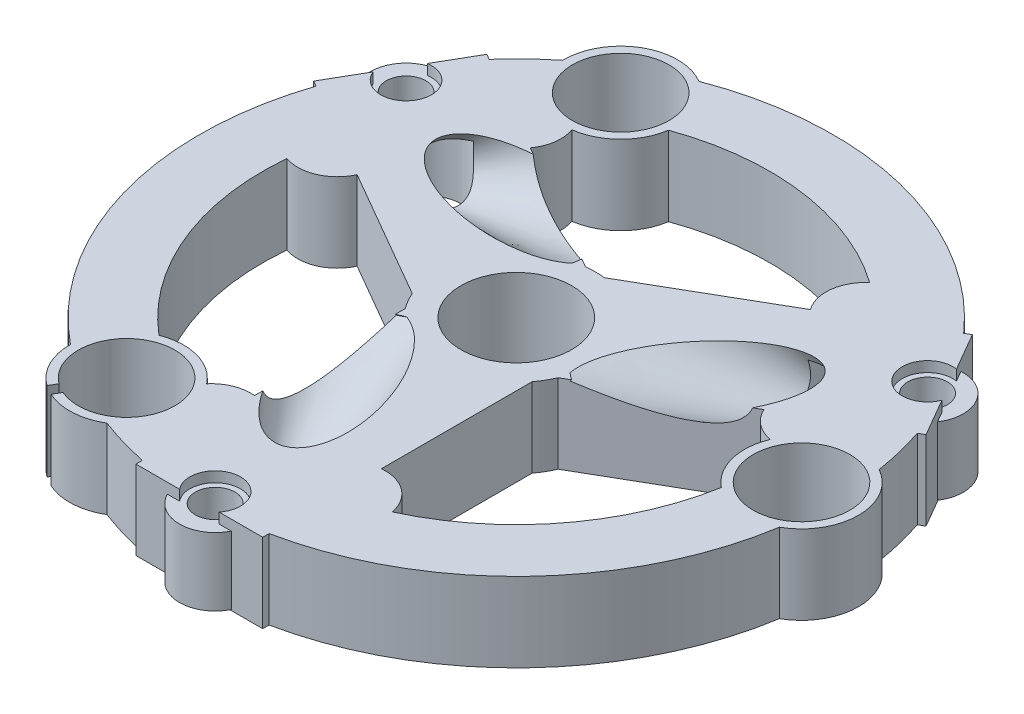
from build123d import *
from build123d.topology import SkipClean

# Parameters (mm, degrees)
MAIN_PROFILE_SKETCH_R              = 6.1
MAIN_EXTRUSION_DEPTH               = 1
DETAIL_PROFILE_2_SKETCH_R          = 6.1
DETAIL_EXTRUSION_2_DEPTH           = 0.31
DETAIL_PROFILE_3_SKETCH_R          = 2.5
DETAIL_PROFILE_3_SKETCH_R_2        = 6.1
DETAIL_EXTRUSION_3_DEPTH           = 0.4
DETAIL_PROFILE_4_SKETCH_R          = 2.5
DETAIL_PROFILE_4_SKETCH_R_2        = 3.95
DETAIL_PROFILE_4_SKETCH_R_3        = 6.1
DETAIL_EXTRUSION_4_DEPTH           = 2.99
DETAIL_PROFILE_5_SKETCH_R          = 1.1
DETAIL_PROFILE_5_SKETCH_R_2        = 2.5
DETAIL_PROFILE_5_SKETCH_R_3        = 3.95
DETAIL_PROFILE_5_SKETCH_R_4        = 6.1
DETAIL_EXTRUSION_5_DEPTH           = 1.3
DETAIL_PROFILE_6_SKETCH_R          = 1.75
DETAIL_PROFILE_6_SKETCH_R_2        = 2.5
DETAIL_PROFILE_6_SKETCH_R_3        = 3.95
DETAIL_PROFILE_6_SKETCH_R_4        = 6.1
DETAIL_EXTRUSION_6_DEPTH           = 3.89
DETAIL_PROFILE_7_SKETCH_R          = 1.75
DETAIL_PROFILE_7_SKETCH_R_2        = 3.95
DETAIL_PROFILE_7_SKETCH_R_3        = 6.1
DETAIL_EXTRUSION_7_DEPTH           = 0.11
CENTRE_INSPECTION_OPENING_SKETCH_R = 7
CENTRE_INSPECTION_OPENING_DEPTH    = 30


with BuildPart() as part:
    # Main Profile Sketch → Main Extrusion (new body)
    with BuildSketch(Plane(origin=(0, -96, 0), x_dir=(-1, 0, 0), z_dir=(0, -1, 0))):
        with BuildLine():
            Line((77.268379179, -37.732758556), (76.715284945, -36.774771242))
            ThreePointArc((76.715284945, -36.774771242), (71.241651246, -25.894159573), (77.92772051, -36.074771242))
            Line((77.92772051, -36.074771242), (78.480814744, -37.032758556))
            ThreePointArc((78.480814744, -37.032758556), (80.720355784, -34.419098671), (81.490773887, -31.064517027))
            ThreePointArc((81.490773887, -31.064517027), (94.694772954, -11.189291445), (94.232776743, 12.667714712))
            Line((94.232776743, 12.667714712), (94.932667397, 13.07179677))
            Line((94.932667397, 13.07179677), (92.181666997, 17.836669235))
            ThreePointArc((92.181666997, 17.836669235), (86.429335298, 17.4), (89.683667798, 22.163330765))
            Line((89.683667798, 22.163330765), (86.932667397, 26.92820323))
            Line((86.932667397, 26.92820323), (86.232776743, 26.524121173))
            ThreePointArc((86.232776743, 26.524121173), (83.955084507, 28.891771496), (81.490773887, 31.064517027))
            ThreePointArc((81.490773887, 31.064517027), (77.891651246, 37.412297443), (70.594750827, 37.355338874))
            ThreePointArc((70.594750827, 37.355338874), (46.780301034, 38.852724707), (26.350525749, 26.524121173))
            Line((26.350525749, 26.524121173), (25.650635095, 26.92820323))
            Line((25.650635095, 26.92820323), (22.899634694, 22.163330765))
            ThreePointArc((22.899634694, 22.163330765), (26.153967194, 17.4), (20.401635495, 17.836669235))
            Line((20.401635495, 17.836669235), (17.650635095, 13.07179677))
            Line((17.650635095, 13.07179677), (18.350525749, 12.667714712))
            ThreePointArc((18.350525749, 12.667714712), (17.438926539, 9.511350212), (16.789429024, 6.290821847))
            ThreePointArc((16.789429024, 6.290821847), (13.091651246, 0), (16.789429024, -6.290821847))
            ThreePointArc((16.789429024, -6.290821847), (27.39987975, -27.663433261), (48.291651246, -39.191835885))
            Line((48.291651246, -39.191835885), (48.291651246, -40))
            Line((48.291651246, -40), (53.793652047, -40))
            ThreePointArc((53.793652047, -40), (56.291651246, -34.8), (58.789650445, -40))
            Line((58.789650445, -40), (64.291651246, -40))
            Line((64.291651246, -40), (64.291651246, -39.191835885))
            ThreePointArc((64.291651246, -39.191835885), (67.480942691, -38.403121708), (70.594750827, -37.355338874))
            ThreePointArc((70.594750827, -37.355338874), (73.885112802, -38.365428047), (77.268379179, -37.732758556))
        make_face()
        with Locations(Location((74.291651246, 31.176914536, 0), (0, 0, 90))):
            Circle(MAIN_PROFILE_SKETCH_R, mode=Mode.SUBTRACT)
        with Locations(Location((20.291651246, 0, 0), (0, 0, 90))):
            Circle(MAIN_PROFILE_SKETCH_R, mode=Mode.SUBTRACT)
        with BuildLine():
            Line((57.487803669, 9.92820323), (73.963991375, 19.440734638))
            ThreePointArc((73.963991375, 19.440734638), (73.071540189, 21.662034378), (73.313956204, 24.043604477))
            ThreePointArc((73.313956204, 24.043604477), (69.238618343, 26.047893335), (67.173727925, 30.09286306))
            ThreePointArc((67.173727925, 30.09286306), (52.019565246, 31.713550435), (37.834445484, 26.14061123))
            ThreePointArc((37.834445484, 26.14061123), (39.526930128, 22.942969172), (38.619311117, 19.440734638))
            Line((38.619311117, 19.440734638), (55.095498823, 9.92820323))
            ThreePointArc((55.095498823, 9.92820323), (56.291651246, 10), (57.487803669, 9.92820323))
        make_face(mode=Mode.SUBTRACT)
        with BuildLine():
            Line((64.291651246, -6), (64.291651246, -25.025062814))
            ThreePointArc((64.291651246, -25.025062814), (66.661578844, -25.362827286), (68.602871042, -26.763550763))
            ThreePointArc((68.602871042, -26.763550763), (72.376305041, -24.236349076), (76.911796789, -24.47058638))
            ThreePointArc((76.911796789, -24.47058638), (85.892434567, -12.157040215), (88.158687522, 2.914103458))
            ThreePointArc((88.158687522, 2.914103458), (84.543205946, 3.04718979), (81.963991375, 5.584328177))
            Line((81.963991375, 5.584328177), (65.487803669, -3.92820323))
            ThreePointArc((65.487803669, -3.92820323), (64.951905284, -5), (64.291651246, -6))
        make_face(mode=Mode.SUBTRACT)
        with BuildLine():
            Line((47.095498823, -3.92820323), (30.619311117, 5.584328177))
            ThreePointArc((30.619311117, 5.584328177), (29.141834705, 3.700792908), (26.958126492, 2.719946286))
            ThreePointArc((26.958126492, 2.719946286), (27.260030354, -1.81154426), (24.789429024, -5.62227668))
            ThreePointArc((24.789429024, -5.62227668), (30.962953925, -19.55651022), (42.881820732, -29.054714688))
            ThreePointArc((42.881820732, -29.054714688), (44.804817664, -25.990158961), (48.291651246, -25.025062814))
            Line((48.291651246, -25.025062814), (48.291651246, -6))
            ThreePointArc((48.291651246, -6), (47.631397208, -5), (47.095498823, -3.92820323))
        make_face(mode=Mode.SUBTRACT)
    extrude(amount=MAIN_EXTRUSION_DEPTH)

    # Detail Profile 2 Sketch → Detail Extrusion 2 (add)
    with BuildSketch(Plane(origin=(0, -97, 0), x_dir=(-1, 0, 0), z_dir=(0, -1, 0))):
        with BuildLine():
            Line((77.268379179, -37.732758556), (76.715284945, -36.774771242))
            ThreePointArc((76.715284945, -36.774771242), (71.241651246, -25.894159573), (77.92772051, -36.074771242))
            Line((77.92772051, -36.074771242), (78.480814744, -37.032758556))
            ThreePointArc((78.480814744, -37.032758556), (80.720355784, -34.419098671), (81.490773887, -31.064517027))
            ThreePointArc((81.490773887, -31.064517027), (94.694772954, -11.189291445), (94.232776743, 12.667714712))
            Line((94.232776743, 12.667714712), (94.932667397, 13.07179677))
            Line((94.932667397, 13.07179677), (92.181666997, 17.836669235))
            ThreePointArc((92.181666997, 17.836669235), (86.429335298, 17.4), (89.683667798, 22.163330765))
            Line((89.683667798, 22.163330765), (86.932667397, 26.92820323))
            Line((86.932667397, 26.92820323), (86.232776743, 26.524121173))
            ThreePointArc((86.232776743, 26.524121173), (83.955084507, 28.891771496), (81.490773887, 31.064517027))
            ThreePointArc((81.490773887, 31.064517027), (77.891651246, 37.412297443), (70.594750827, 37.355338874))
            ThreePointArc((70.594750827, 37.355338874), (46.780301034, 38.852724707), (26.350525749, 26.524121173))
            Line((26.350525749, 26.524121173), (25.650635095, 26.92820323))
            Line((25.650635095, 26.92820323), (22.899634694, 22.163330765))
            ThreePointArc((22.899634694, 22.163330765), (26.153967194, 17.4), (20.401635495, 17.836669235))
            Line((20.401635495, 17.836669235), (17.650635095, 13.07179677))
            Line((17.650635095, 13.07179677), (18.350525749, 12.667714712))
            ThreePointArc((18.350525749, 12.667714712), (17.438926539, 9.511350212), (16.789429024, 6.290821847))
            ThreePointArc((16.789429024, 6.290821847), (13.091651246, 0), (16.789429024, -6.290821847))
            ThreePointArc((16.789429024, -6.290821847), (27.39987975, -27.663433261), (48.291651246, -39.191835885))
            Line((48.291651246, -39.191835885), (48.291651246, -40))
            Line((48.291651246, -40), (53.793652047, -40))
            ThreePointArc((53.793652047, -40), (56.291651246, -34.8), (58.789650445, -40))
            Line((58.789650445, -40), (64.291651246, -40))
            Line((64.291651246, -40), (64.291651246, -39.191835885))
            ThreePointArc((64.291651246, -39.191835885), (67.480942691, -38.403121708), (70.594750827, -37.355338874))
            ThreePointArc((70.594750827, -37.355338874), (73.885112802, -38.365428047), (77.268379179, -37.732758556))
        make_face()
        with Locations(Location((74.291651246, 31.176914536, 0), (0, 0, 90))):
            Circle(DETAIL_PROFILE_2_SKETCH_R, mode=Mode.SUBTRACT)
        with Locations(Location((20.291651246, 0, 0), (0, 0, 90))):
            Circle(DETAIL_PROFILE_2_SKETCH_R, mode=Mode.SUBTRACT)
        with BuildLine():
            Line((79.12241336, 17.383275058), (79.12241336, 12.616724942))
            ThreePointArc((79.12241336, 12.616724942), (86.22241336, 15), (79.12241336, 17.383275058))
        make_face(mode=Mode.SUBTRACT)
        with BuildLine():
            Line((57.487803669, 9.92820323), (73.963991375, 19.440734638))
            ThreePointArc((73.963991375, 19.440734638), (73.071540189, 21.662034378), (73.313956204, 24.043604477))
            ThreePointArc((73.313956204, 24.043604477), (69.238618343, 26.047893335), (67.173727925, 30.09286306))
            ThreePointArc((67.173727925, 30.09286306), (52.019565246, 31.713550435), (37.834445484, 26.14061123))
            ThreePointArc((37.834445484, 26.14061123), (39.526930128, 22.942969172), (38.619311117, 19.440734638))
            Line((38.619311117, 19.440734638), (55.095498823, 9.92820323))
            ThreePointArc((55.095498823, 9.92820323), (56.291651246, 10), (57.487803669, 9.92820323))
        make_face(mode=Mode.SUBTRACT)
        with BuildLine():
            Line((64.291651246, -6), (64.291651246, -25.025062814))
            ThreePointArc((64.291651246, -25.025062814), (66.661578844, -25.362827286), (68.602871042, -26.763550763))
            ThreePointArc((68.602871042, -26.763550763), (72.376305041, -24.236349076), (76.911796789, -24.47058638))
            ThreePointArc((76.911796789, -24.47058638), (85.892434567, -12.157040215), (88.158687522, 2.914103458))
            ThreePointArc((88.158687522, 2.914103458), (84.543205946, 3.04718979), (81.963991375, 5.584328177))
            Line((81.963991375, 5.584328177), (65.487803669, -3.92820323))
            ThreePointArc((65.487803669, -3.92820323), (64.951905284, -5), (64.291651246, -6))
        make_face(mode=Mode.SUBTRACT)
        with BuildLine():
            Line((59.93062799, -28.463657507), (55.802674502, -26.080382449))
            ThreePointArc((55.802674502, -26.080382449), (53.330742759, -27.385517082), (52.341651246, -30))
            ThreePointArc((52.341651246, -30), (57.075405627, -33.871463427), (59.93062799, -28.463657507))
        make_face(mode=Mode.SUBTRACT)
        with BuildLine():
            Line((29.821912388, 11.080382449), (33.949865877, 13.463657507))
            ThreePointArc((33.949865877, 13.463657507), (31.094643514, 18.871463427), (26.360889132, 15))
            ThreePointArc((26.360889132, 15), (27.349980645, 12.385517082), (29.821912388, 11.080382449))
        make_face(mode=Mode.SUBTRACT)
        with BuildLine():
            Line((47.095498823, -3.92820323), (30.619311117, 5.584328177))
            ThreePointArc((30.619311117, 5.584328177), (29.141834705, 3.700792908), (26.958126492, 2.719946286))
            ThreePointArc((26.958126492, 2.719946286), (27.260030354, -1.81154426), (24.789429024, -5.62227668))
            ThreePointArc((24.789429024, -5.62227668), (30.962953925, -19.55651022), (42.881820732, -29.054714688))
            ThreePointArc((42.881820732, -29.054714688), (44.804817664, -25.990158961), (48.291651246, -25.025062814))
            Line((48.291651246, -25.025062814), (48.291651246, -6))
            ThreePointArc((48.291651246, -6), (47.631397208, -5), (47.095498823, -3.92820323))
        make_face(mode=Mode.SUBTRACT)
    extrude(amount=DETAIL_EXTRUSION_2_DEPTH)

    # Detail Profile 3 Sketch → Detail Extrusion 3 (add)
    with BuildSketch(Plane(origin=(0, -97.31, 0), x_dir=(-1, 0, 0), z_dir=(0, -1, 0))):
        with BuildLine():
            Line((77.268379179, -37.732758556), (76.715284945, -36.774771242))
            ThreePointArc((76.715284945, -36.774771242), (71.241651246, -25.894159573), (77.92772051, -36.074771242))
            Line((77.92772051, -36.074771242), (78.480814744, -37.032758556))
            ThreePointArc((78.480814744, -37.032758556), (80.720355784, -34.419098671), (81.490773887, -31.064517027))
            ThreePointArc((81.490773887, -31.064517027), (94.694772954, -11.189291445), (94.232776743, 12.667714712))
            Line((94.232776743, 12.667714712), (94.932667397, 13.07179677))
            Line((94.932667397, 13.07179677), (92.948231834, 16.508939989))
            ThreePointArc((92.948231834, 16.508939989), (93.097730907, 21.25), (88.91710296, 23.491060011))
            Line((88.91710296, 23.491060011), (86.932667397, 26.92820323))
            Line((86.932667397, 26.92820323), (86.232776743, 26.524121173))
            ThreePointArc((86.232776743, 26.524121173), (83.955084507, 28.891771496), (81.490773887, 31.064517027))
            ThreePointArc((81.490773887, 31.064517027), (77.891651246, 37.412297443), (70.594750827, 37.355338874))
            ThreePointArc((70.594750827, 37.355338874), (46.780301034, 38.852724707), (26.350525749, 26.524121173))
            Line((26.350525749, 26.524121173), (25.650635095, 26.92820323))
            Line((25.650635095, 26.92820323), (23.666199532, 23.491060011))
            ThreePointArc((23.666199532, 23.491060011), (19.485571585, 21.25), (19.635070658, 16.508939989))
            Line((19.635070658, 16.508939989), (17.650635095, 13.07179677))
            Line((17.650635095, 13.07179677), (18.350525749, 12.667714712))
            ThreePointArc((18.350525749, 12.667714712), (17.438926539, 9.511350212), (16.789429024, 6.290821847))
            ThreePointArc((16.789429024, 6.290821847), (13.091651246, 0), (16.789429024, -6.290821847))
            ThreePointArc((16.789429024, -6.290821847), (27.39987975, -27.663433261), (48.291651246, -39.191835885))
            Line((48.291651246, -39.191835885), (48.291651246, -40))
            Line((48.291651246, -40), (52.260522372, -40))
            ThreePointArc((52.260522372, -40), (56.291651246, -42.5), (60.32278012, -40))
            Line((60.32278012, -40), (64.291651246, -40))
            Line((64.291651246, -40), (64.291651246, -39.191835885))
            ThreePointArc((64.291651246, -39.191835885), (67.480942691, -38.403121708), (70.594750827, -37.355338874))
            ThreePointArc((70.594750827, -37.355338874), (73.885112802, -38.365428047), (77.268379179, -37.732758556))
        make_face()
        with Locations(Location((89.20061659, 19, 0), (0, 0, 90))):
            Circle(DETAIL_PROFILE_3_SKETCH_R, mode=Mode.SUBTRACT)
        with Locations(Location((74.291651246, 31.176914536, 0), (0, 0, 90))):
            Circle(DETAIL_PROFILE_3_SKETCH_R_2, mode=Mode.SUBTRACT)
        with Locations(Location((56.291651246, -38, 0), (0, 0, 90))):
            Circle(DETAIL_PROFILE_3_SKETCH_R, mode=Mode.SUBTRACT)
        with Locations(Location((23.382685902, 19, 0), (0, 0, 90))):
            Circle(DETAIL_PROFILE_3_SKETCH_R, mode=Mode.SUBTRACT)
        with Locations(Location((20.291651246, 0, 0), (0, 0, 90))):
            Circle(DETAIL_PROFILE_3_SKETCH_R_2, mode=Mode.SUBTRACT)
        with BuildLine():
            Line((79.12241336, 17.383275058), (79.12241336, 12.616724942))
            ThreePointArc((79.12241336, 12.616724942), (86.22241336, 15), (79.12241336, 17.383275058))
        make_face(mode=Mode.SUBTRACT)
        with BuildLine():
            Line((57.487803669, 9.92820323), (73.963991375, 19.440734638))
            ThreePointArc((73.963991375, 19.440734638), (73.071540189, 21.662034378), (73.313956204, 24.043604477))
            ThreePointArc((73.313956204, 24.043604477), (69.238618343, 26.047893335), (67.173727925, 30.09286306))
            ThreePointArc((67.173727925, 30.09286306), (52.019565246, 31.713550435), (37.834445484, 26.14061123))
            ThreePointArc((37.834445484, 26.14061123), (39.526930128, 22.942969172), (38.619311117, 19.440734638))
            Line((38.619311117, 19.440734638), (55.095498823, 9.92820323))
            ThreePointArc((55.095498823, 9.92820323), (56.291651246, 10), (57.487803669, 9.92820323))
        make_face(mode=Mode.SUBTRACT)
        with BuildLine():
            Line((64.291651246, -6), (64.291651246, -25.025062814))
            ThreePointArc((64.291651246, -25.025062814), (66.661578844, -25.362827286), (68.602871042, -26.763550763))
            ThreePointArc((68.602871042, -26.763550763), (72.376305041, -24.236349076), (76.911796789, -24.47058638))
            ThreePointArc((76.911796789, -24.47058638), (85.892434567, -12.157040215), (88.158687522, 2.914103458))
            ThreePointArc((88.158687522, 2.914103458), (84.543205946, 3.04718979), (81.963991375, 5.584328177))
            Line((81.963991375, 5.584328177), (65.487803669, -3.92820323))
            ThreePointArc((65.487803669, -3.92820323), (64.951905284, -5), (64.291651246, -6))
        make_face(mode=Mode.SUBTRACT)
        with BuildLine():
            Line((59.93062799, -28.463657507), (55.802674502, -26.080382449))
            ThreePointArc((55.802674502, -26.080382449), (53.330742759, -27.385517082), (52.341651246, -30))
            ThreePointArc((52.341651246, -30), (57.075405627, -33.871463427), (59.93062799, -28.463657507))
        make_face(mode=Mode.SUBTRACT)
        with BuildLine():
            Line((29.821912388, 11.080382449), (33.949865877, 13.463657507))
            ThreePointArc((33.949865877, 13.463657507), (31.094643514, 18.871463427), (26.360889132, 15))
            ThreePointArc((26.360889132, 15), (27.349980645, 12.385517082), (29.821912388, 11.080382449))
        make_face(mode=Mode.SUBTRACT)
        with BuildLine():
            Line((47.095498823, -3.92820323), (30.619311117, 5.584328177))
            ThreePointArc((30.619311117, 5.584328177), (29.141834705, 3.700792908), (26.958126492, 2.719946286))
            ThreePointArc((26.958126492, 2.719946286), (27.260030354, -1.81154426), (24.789429024, -5.62227668))
            ThreePointArc((24.789429024, -5.62227668), (30.962953925, -19.55651022), (42.881820732, -29.054714688))
            ThreePointArc((42.881820732, -29.054714688), (44.804817664, -25.990158961), (48.291651246, -25.025062814))
            Line((48.291651246, -25.025062814), (48.291651246, -6))
            ThreePointArc((48.291651246, -6), (47.631397208, -5), (47.095498823, -3.92820323))
        make_face(mode=Mode.SUBTRACT)
    extrude(amount=DETAIL_EXTRUSION_3_DEPTH)

    # Detail Profile 4 Sketch → Detail Extrusion 4 (add)
    with BuildSketch(Plane(origin=(0, -97.71, 0), x_dir=(-1, 0, 0), z_dir=(0, -1, 0))):
        with BuildLine():
            Line((77.268379179, -37.732758556), (76.715284945, -36.774771242))
            ThreePointArc((76.715284945, -36.774771242), (71.241651246, -25.894159573), (77.92772051, -36.074771242))
            Line((77.92772051, -36.074771242), (78.480814744, -37.032758556))
            ThreePointArc((78.480814744, -37.032758556), (80.720355784, -34.419098671), (81.490773887, -31.064517027))
            ThreePointArc((81.490773887, -31.064517027), (94.694772954, -11.189291445), (94.232776743, 12.667714712))
            Line((94.232776743, 12.667714712), (94.932667397, 13.07179677))
            Line((94.932667397, 13.07179677), (92.948231834, 16.508939989))
            ThreePointArc((92.948231834, 16.508939989), (93.097730907, 21.25), (88.91710296, 23.491060011))
            Line((88.91710296, 23.491060011), (86.932667397, 26.92820323))
            Line((86.932667397, 26.92820323), (86.232776743, 26.524121173))
            ThreePointArc((86.232776743, 26.524121173), (83.955084507, 28.891771496), (81.490773887, 31.064517027))
            ThreePointArc((81.490773887, 31.064517027), (77.891651246, 37.412297443), (70.594750827, 37.355338874))
            ThreePointArc((70.594750827, 37.355338874), (46.780301034, 38.852724707), (26.350525749, 26.524121173))
            Line((26.350525749, 26.524121173), (25.650635095, 26.92820323))
            Line((25.650635095, 26.92820323), (23.666199532, 23.491060011))
            ThreePointArc((23.666199532, 23.491060011), (19.485571585, 21.25), (19.635070658, 16.508939989))
            Line((19.635070658, 16.508939989), (17.650635095, 13.07179677))
            Line((17.650635095, 13.07179677), (18.350525749, 12.667714712))
            ThreePointArc((18.350525749, 12.667714712), (17.438926539, 9.511350212), (16.789429024, 6.290821847))
            ThreePointArc((16.789429024, 6.290821847), (13.091651246, 0), (16.789429024, -6.290821847))
            ThreePointArc((16.789429024, -6.290821847), (27.39987975, -27.663433261), (48.291651246, -39.191835885))
            Line((48.291651246, -39.191835885), (48.291651246, -40))
            Line((48.291651246, -40), (52.260522372, -40))
            ThreePointArc((52.260522372, -40), (56.291651246, -42.5), (60.32278012, -40))
            Line((60.32278012, -40), (64.291651246, -40))
            Line((64.291651246, -40), (64.291651246, -39.191835885))
            ThreePointArc((64.291651246, -39.191835885), (67.480942691, -38.403121708), (70.594750827, -37.355338874))
            ThreePointArc((70.594750827, -37.355338874), (73.885112802, -38.365428047), (77.268379179, -37.732758556))
        make_face()
        with Locations(Location((89.20061659, 19, 0), (0, 0, 90))):
            Circle(DETAIL_PROFILE_4_SKETCH_R, mode=Mode.SUBTRACT)
        with Locations(Location((82.27241336, 15, 0), (0, 0, 217.110976457))):
            Circle(DETAIL_PROFILE_4_SKETCH_R_2, mode=Mode.SUBTRACT)
        with Locations(Location((74.291651246, 31.176914536, 0), (0, 0, 90))):
            Circle(DETAIL_PROFILE_4_SKETCH_R_3, mode=Mode.SUBTRACT)
        with Locations(Location((56.291651246, -30, 0), (0, 0, 22.889023543))):
            Circle(DETAIL_PROFILE_4_SKETCH_R_2, mode=Mode.SUBTRACT)
        with Locations(Location((56.291651246, -38, 0), (0, 0, 90))):
            Circle(DETAIL_PROFILE_4_SKETCH_R, mode=Mode.SUBTRACT)
        with Locations(Location((30.310889132, 15, 0), (0, 0, 262.889023543))):
            Circle(DETAIL_PROFILE_4_SKETCH_R_2, mode=Mode.SUBTRACT)
        with Locations(Location((23.382685902, 19, 0), (0, 0, 90))):
            Circle(DETAIL_PROFILE_4_SKETCH_R, mode=Mode.SUBTRACT)
        with Locations(Location((20.291651246, 0, 0), (0, 0, 90))):
            Circle(DETAIL_PROFILE_4_SKETCH_R_3, mode=Mode.SUBTRACT)
        with BuildLine():
            Line((57.487803669, 9.92820323), (73.963991375, 19.440734638))
            ThreePointArc((73.963991375, 19.440734638), (73.071540189, 21.662034378), (73.313956204, 24.043604477))
            ThreePointArc((73.313956204, 24.043604477), (69.238618343, 26.047893335), (67.173727925, 30.09286306))
            ThreePointArc((67.173727925, 30.09286306), (52.019565246, 31.713550435), (37.834445484, 26.14061123))
            ThreePointArc((37.834445484, 26.14061123), (39.526930128, 22.942969172), (38.619311117, 19.440734638))
            Line((38.619311117, 19.440734638), (55.095498823, 9.92820323))
            ThreePointArc((55.095498823, 9.92820323), (56.291651246, 10), (57.487803669, 9.92820323))
        make_face(mode=Mode.SUBTRACT)
        with BuildLine():
            Line((64.291651246, -6), (64.291651246, -25.025062814))
            ThreePointArc((64.291651246, -25.025062814), (66.661578844, -25.362827286), (68.602871042, -26.763550763))
            ThreePointArc((68.602871042, -26.763550763), (72.376305041, -24.236349076), (76.911796789, -24.47058638))
            ThreePointArc((76.911796789, -24.47058638), (85.892434567, -12.157040215), (88.158687522, 2.914103458))
            ThreePointArc((88.158687522, 2.914103458), (84.543205946, 3.04718979), (81.963991375, 5.584328177))
            Line((81.963991375, 5.584328177), (65.487803669, -3.92820323))
            ThreePointArc((65.487803669, -3.92820323), (64.951905284, -5), (64.291651246, -6))
        make_face(mode=Mode.SUBTRACT)
        with BuildLine():
            Line((47.095498823, -3.92820323), (30.619311117, 5.584328177))
            ThreePointArc((30.619311117, 5.584328177), (29.141834705, 3.700792908), (26.958126492, 2.719946286))
            ThreePointArc((26.958126492, 2.719946286), (27.260030354, -1.81154426), (24.789429024, -5.62227668))
            ThreePointArc((24.789429024, -5.62227668), (30.962953925, -19.55651022), (42.881820732, -29.054714688))
            ThreePointArc((42.881820732, -29.054714688), (44.804817664, -25.990158961), (48.291651246, -25.025062814))
            Line((48.291651246, -25.025062814), (48.291651246, -6))
            ThreePointArc((48.291651246, -6), (47.631397208, -5), (47.095498823, -3.92820323))
        make_face(mode=Mode.SUBTRACT)
    extrude(amount=DETAIL_EXTRUSION_4_DEPTH)

    # Detail Profile 5 Sketch → Detail Extrusion 5 (add)
    with BuildSketch(Plane(origin=(0, -100.7, 0), x_dir=(-1, 0, 0), z_dir=(0, -1, 0))):
        with BuildLine():
            Line((77.268379179, -37.732758556), (76.715284945, -36.774771242))
            ThreePointArc((76.715284945, -36.774771242), (71.241651246, -25.894159573), (77.92772051, -36.074771242))
            Line((77.92772051, -36.074771242), (78.480814744, -37.032758556))
            ThreePointArc((78.480814744, -37.032758556), (80.720355784, -34.419098671), (81.490773887, -31.064517027))
            ThreePointArc((81.490773887, -31.064517027), (94.694772954, -11.189291445), (94.232776743, 12.667714712))
            Line((94.232776743, 12.667714712), (94.932667397, 13.07179677))
            Line((94.932667397, 13.07179677), (92.948231834, 16.508939989))
            ThreePointArc((92.948231834, 16.508939989), (93.097730907, 21.25), (88.91710296, 23.491060011))
            Line((88.91710296, 23.491060011), (86.932667397, 26.92820323))
            Line((86.932667397, 26.92820323), (86.232776743, 26.524121173))
            ThreePointArc((86.232776743, 26.524121173), (83.955084507, 28.891771496), (81.490773887, 31.064517027))
            ThreePointArc((81.490773887, 31.064517027), (77.891651246, 37.412297443), (70.594750827, 37.355338874))
            ThreePointArc((70.594750827, 37.355338874), (46.780301034, 38.852724707), (26.350525749, 26.524121173))
            Line((26.350525749, 26.524121173), (25.650635095, 26.92820323))
            Line((25.650635095, 26.92820323), (23.666199532, 23.491060011))
            ThreePointArc((23.666199532, 23.491060011), (19.485571585, 21.25), (19.635070658, 16.508939989))
            Line((19.635070658, 16.508939989), (17.650635095, 13.07179677))
            Line((17.650635095, 13.07179677), (18.350525749, 12.667714712))
            ThreePointArc((18.350525749, 12.667714712), (17.438926539, 9.511350212), (16.789429024, 6.290821847))
            ThreePointArc((16.789429024, 6.290821847), (13.091651246, 0), (16.789429024, -6.290821847))
            ThreePointArc((16.789429024, -6.290821847), (27.39987975, -27.663433261), (48.291651246, -39.191835885))
            Line((48.291651246, -39.191835885), (48.291651246, -40))
            Line((48.291651246, -40), (52.260522372, -40))
            ThreePointArc((52.260522372, -40), (56.291651246, -42.5), (60.32278012, -40))
            Line((60.32278012, -40), (64.291651246, -40))
            Line((64.291651246, -40), (64.291651246, -39.191835885))
            ThreePointArc((64.291651246, -39.191835885), (67.480942691, -38.403121708), (70.594750827, -37.355338874))
            ThreePointArc((70.594750827, -37.355338874), (73.885112802, -38.365428047), (77.268379179, -37.732758556))
        make_face()
        with Locations(Location((78.02241336, 22.361215932, 0), (0, 0, 90))):
            Circle(DETAIL_PROFILE_5_SKETCH_R, mode=Mode.SUBTRACT)
        with Locations(Location((89.20061659, 19, 0), (0, 0, 90))):
            Circle(DETAIL_PROFILE_5_SKETCH_R_2, mode=Mode.SUBTRACT)
        with Locations(Location((86.52241336, 7.638784068, 0), (0, 0, 90))):
            Circle(DETAIL_PROFILE_5_SKETCH_R, mode=Mode.SUBTRACT)
        with Locations(Location((82.27241336, 15, 0), (0, 0, 217.110976457))):
            Circle(DETAIL_PROFILE_5_SKETCH_R_3, mode=Mode.SUBTRACT)
        with Locations(Location((74.291651246, 31.176914536, 0), (0, 0, 90))):
            Circle(DETAIL_PROFILE_5_SKETCH_R_4, mode=Mode.SUBTRACT)
        with Locations(Location((64.791651246, -30, 0), (0, 0, 90))):
            Circle(DETAIL_PROFILE_5_SKETCH_R, mode=Mode.SUBTRACT)
        with Locations(Location((56.291651246, -30, 0), (0, 0, 22.889023543))):
            Circle(DETAIL_PROFILE_5_SKETCH_R_3, mode=Mode.SUBTRACT)
        with Locations(Location((56.291651246, -38, 0), (0, 0, 90))):
            Circle(DETAIL_PROFILE_5_SKETCH_R_2, mode=Mode.SUBTRACT)
        with Locations(Location((34.560889132, 22.361215932, 0), (0, 0, 90))):
            Circle(DETAIL_PROFILE_5_SKETCH_R, mode=Mode.SUBTRACT)
        with Locations(Location((30.310889132, 15, 0), (0, 0, 262.889023543))):
            Circle(DETAIL_PROFILE_5_SKETCH_R_3, mode=Mode.SUBTRACT)
        with Locations(Location((26.060889132, 7.638784068, 0), (0, 0, 90))):
            Circle(DETAIL_PROFILE_5_SKETCH_R, mode=Mode.SUBTRACT)
        with Locations(Location((23.382685902, 19, 0), (0, 0, 90))):
            Circle(DETAIL_PROFILE_5_SKETCH_R_2, mode=Mode.SUBTRACT)
        with Locations(Location((20.291651246, 0, 0), (0, 0, 90))):
            Circle(DETAIL_PROFILE_5_SKETCH_R_4, mode=Mode.SUBTRACT)
        with Locations(Location((47.791651246, -30, 0), (0, 0, 90))):
            Circle(DETAIL_PROFILE_5_SKETCH_R, mode=Mode.SUBTRACT)
        with BuildLine():
            Line((57.487803669, 9.92820323), (73.963991375, 19.440734638))
            ThreePointArc((73.963991375, 19.440734638), (73.071540189, 21.662034378), (73.313956204, 24.043604477))
            ThreePointArc((73.313956204, 24.043604477), (69.238618343, 26.047893335), (67.173727925, 30.09286306))
            ThreePointArc((67.173727925, 30.09286306), (52.019565246, 31.713550435), (37.834445484, 26.14061123))
            ThreePointArc((37.834445484, 26.14061123), (39.526930128, 22.942969172), (38.619311117, 19.440734638))
            Line((38.619311117, 19.440734638), (55.095498823, 9.92820323))
            ThreePointArc((55.095498823, 9.92820323), (56.291651246, 10), (57.487803669, 9.92820323))
        make_face(mode=Mode.SUBTRACT)
        with BuildLine():
            Line((64.291651246, -6), (64.291651246, -25.025062814))
            ThreePointArc((64.291651246, -25.025062814), (66.661578844, -25.362827286), (68.602871042, -26.763550763))
            ThreePointArc((68.602871042, -26.763550763), (72.376305041, -24.236349076), (76.911796789, -24.47058638))
            ThreePointArc((76.911796789, -24.47058638), (85.892434567, -12.157040215), (88.158687522, 2.914103458))
            ThreePointArc((88.158687522, 2.914103458), (84.543205946, 3.04718979), (81.963991375, 5.584328177))
            Line((81.963991375, 5.584328177), (65.487803669, -3.92820323))
            ThreePointArc((65.487803669, -3.92820323), (64.951905284, -5), (64.291651246, -6))
        make_face(mode=Mode.SUBTRACT)
        with BuildLine():
            Line((47.095498823, -3.92820323), (30.619311117, 5.584328177))
            ThreePointArc((30.619311117, 5.584328177), (29.141834705, 3.700792908), (26.958126492, 2.719946286))
            ThreePointArc((26.958126492, 2.719946286), (27.260030354, -1.81154426), (24.789429024, -5.62227668))
            ThreePointArc((24.789429024, -5.62227668), (30.962953925, -19.55651022), (42.881820732, -29.054714688))
            ThreePointArc((42.881820732, -29.054714688), (44.804817664, -25.990158961), (48.291651246, -25.025062814))
            Line((48.291651246, -25.025062814), (48.291651246, -6))
            ThreePointArc((48.291651246, -6), (47.631397208, -5), (47.095498823, -3.92820323))
        make_face(mode=Mode.SUBTRACT)
    extrude(amount=DETAIL_EXTRUSION_5_DEPTH)

    # Detail Profile 6 Sketch → Detail Extrusion 6 (add)
    with BuildSketch(Plane(origin=(0, -102, 0), x_dir=(-1, 0, 0), z_dir=(0, -1, 0))):
        with BuildLine():
            Line((77.268379179, -37.732758556), (76.715284945, -36.774771242))
            ThreePointArc((76.715284945, -36.774771242), (71.241651246, -25.894159573), (77.92772051, -36.074771242))
            Line((77.92772051, -36.074771242), (78.480814744, -37.032758556))
            ThreePointArc((78.480814744, -37.032758556), (80.720355784, -34.419098671), (81.490773887, -31.064517027))
            ThreePointArc((81.490773887, -31.064517027), (94.694772954, -11.189291445), (94.232776743, 12.667714712))
            Line((94.232776743, 12.667714712), (94.932667397, 13.07179677))
            Line((94.932667397, 13.07179677), (92.948231834, 16.508939989))
            ThreePointArc((92.948231834, 16.508939989), (93.097730907, 21.25), (88.91710296, 23.491060011))
            Line((88.91710296, 23.491060011), (86.932667397, 26.92820323))
            Line((86.932667397, 26.92820323), (86.232776743, 26.524121173))
            ThreePointArc((86.232776743, 26.524121173), (83.955084507, 28.891771496), (81.490773887, 31.064517027))
            ThreePointArc((81.490773887, 31.064517027), (77.891651246, 37.412297443), (70.594750827, 37.355338874))
            ThreePointArc((70.594750827, 37.355338874), (46.780301034, 38.852724707), (26.350525749, 26.524121173))
            Line((26.350525749, 26.524121173), (25.650635095, 26.92820323))
            Line((25.650635095, 26.92820323), (23.666199532, 23.491060011))
            ThreePointArc((23.666199532, 23.491060011), (19.485571585, 21.25), (19.635070658, 16.508939989))
            Line((19.635070658, 16.508939989), (17.650635095, 13.07179677))
            Line((17.650635095, 13.07179677), (18.350525749, 12.667714712))
            ThreePointArc((18.350525749, 12.667714712), (17.438926539, 9.511350212), (16.789429024, 6.290821847))
            ThreePointArc((16.789429024, 6.290821847), (13.091651246, 0), (16.789429024, -6.290821847))
            ThreePointArc((16.789429024, -6.290821847), (27.39987975, -27.663433261), (48.291651246, -39.191835885))
            Line((48.291651246, -39.191835885), (48.291651246, -40))
            Line((48.291651246, -40), (52.260522372, -40))
            ThreePointArc((52.260522372, -40), (56.291651246, -42.5), (60.32278012, -40))
            Line((60.32278012, -40), (64.291651246, -40))
            Line((64.291651246, -40), (64.291651246, -39.191835885))
            ThreePointArc((64.291651246, -39.191835885), (67.480942691, -38.403121708), (70.594750827, -37.355338874))
            ThreePointArc((70.594750827, -37.355338874), (73.885112802, -38.365428047), (77.268379179, -37.732758556))
        make_face()
        with Locations(Location((78.02241336, 22.361215932, 0), (0, 0, 90))):
            Circle(DETAIL_PROFILE_6_SKETCH_R, mode=Mode.SUBTRACT)
        with Locations(Location((89.20061659, 19, 0), (0, 0, 90))):
            Circle(DETAIL_PROFILE_6_SKETCH_R_2, mode=Mode.SUBTRACT)
        with Locations(Location((86.52241336, 7.638784068, 0), (0, 0, 90))):
            Circle(DETAIL_PROFILE_6_SKETCH_R, mode=Mode.SUBTRACT)
        with Locations(Location((82.27241336, 15, 0), (0, 0, 217.110976457))):
            Circle(DETAIL_PROFILE_6_SKETCH_R_3, mode=Mode.SUBTRACT)
        with Locations(Location((74.291651246, 31.176914536, 0), (0, 0, 90))):
            Circle(DETAIL_PROFILE_6_SKETCH_R_4, mode=Mode.SUBTRACT)
        with Locations(Location((64.791651246, -30, 0), (0, 0, 90))):
            Circle(DETAIL_PROFILE_6_SKETCH_R, mode=Mode.SUBTRACT)
        with Locations(Location((56.291651246, -30, 0), (0, 0, 22.889023543))):
            Circle(DETAIL_PROFILE_6_SKETCH_R_3, mode=Mode.SUBTRACT)
        with Locations(Location((56.291651246, -38, 0), (0, 0, 90))):
            Circle(DETAIL_PROFILE_6_SKETCH_R_2, mode=Mode.SUBTRACT)
        with Locations(Location((34.560889132, 22.361215932, 0), (0, 0, 90))):
            Circle(DETAIL_PROFILE_6_SKETCH_R, mode=Mode.SUBTRACT)
        with Locations(Location((30.310889132, 15, 0), (0, 0, 262.889023543))):
            Circle(DETAIL_PROFILE_6_SKETCH_R_3, mode=Mode.SUBTRACT)
        with Locations(Location((26.060889132, 7.638784068, 0), (0, 0, 90))):
            Circle(DETAIL_PROFILE_6_SKETCH_R, mode=Mode.SUBTRACT)
        with Locations(Location((23.382685902, 19, 0), (0, 0, 90))):
            Circle(DETAIL_PROFILE_6_SKETCH_R_2, mode=Mode.SUBTRACT)
        with Locations(Location((20.291651246, 0, 0), (0, 0, 90))):
            Circle(DETAIL_PROFILE_6_SKETCH_R_4, mode=Mode.SUBTRACT)
        with Locations(Location((47.791651246, -30, 0), (0, 0, 90))):
            Circle(DETAIL_PROFILE_6_SKETCH_R, mode=Mode.SUBTRACT)
        with BuildLine():
            Line((57.487803669, 9.92820323), (73.963991375, 19.440734638))
            ThreePointArc((73.963991375, 19.440734638), (73.071540189, 21.662034378), (73.313956204, 24.043604477))
            ThreePointArc((73.313956204, 24.043604477), (69.238618343, 26.047893335), (67.173727925, 30.09286306))
            ThreePointArc((67.173727925, 30.09286306), (52.019565246, 31.713550435), (37.834445484, 26.14061123))
            ThreePointArc((37.834445484, 26.14061123), (39.526930128, 22.942969172), (38.619311117, 19.440734638))
            Line((38.619311117, 19.440734638), (55.095498823, 9.92820323))
            ThreePointArc((55.095498823, 9.92820323), (56.291651246, 10), (57.487803669, 9.92820323))
        make_face(mode=Mode.SUBTRACT)
        with BuildLine():
            Line((64.291651246, -6), (64.291651246, -25.025062814))
            ThreePointArc((64.291651246, -25.025062814), (66.661578844, -25.362827286), (68.602871042, -26.763550763))
            ThreePointArc((68.602871042, -26.763550763), (72.376305041, -24.236349076), (76.911796789, -24.47058638))
            ThreePointArc((76.911796789, -24.47058638), (85.892434567, -12.157040215), (88.158687522, 2.914103458))
            ThreePointArc((88.158687522, 2.914103458), (84.543205946, 3.04718979), (81.963991375, 5.584328177))
            Line((81.963991375, 5.584328177), (65.487803669, -3.92820323))
            ThreePointArc((65.487803669, -3.92820323), (64.951905284, -5), (64.291651246, -6))
        make_face(mode=Mode.SUBTRACT)
        with BuildLine():
            Line((47.095498823, -3.92820323), (30.619311117, 5.584328177))
            ThreePointArc((30.619311117, 5.584328177), (29.141834705, 3.700792908), (26.958126492, 2.719946286))
            ThreePointArc((26.958126492, 2.719946286), (27.260030354, -1.81154426), (24.789429024, -5.62227668))
            ThreePointArc((24.789429024, -5.62227668), (30.962953925, -19.55651022), (42.881820732, -29.054714688))
            ThreePointArc((42.881820732, -29.054714688), (44.804817664, -25.990158961), (48.291651246, -25.025062814))
            Line((48.291651246, -25.025062814), (48.291651246, -6))
            ThreePointArc((48.291651246, -6), (47.631397208, -5), (47.095498823, -3.92820323))
        make_face(mode=Mode.SUBTRACT)
    extrude(amount=DETAIL_EXTRUSION_6_DEPTH)

    # Detail Profile 7 Sketch → Detail Extrusion 7 (add)
    with SkipClean():  # the faces are left unmerged after this step: merging them gives an invalid solid
        with BuildSketch(Plane(origin=(0, -105.89, 0), x_dir=(-1, 0, 0), z_dir=(0, -1, 0))):
            with BuildLine():
                Line((77.268379179, -37.732758556), (76.715284945, -36.774771242))
                ThreePointArc((76.715284945, -36.774771242), (71.241651246, -25.894159573), (77.92772051, -36.074771242))
                Line((77.92772051, -36.074771242), (78.480814744, -37.032758556))
                ThreePointArc((78.480814744, -37.032758556), (80.720355784, -34.419098671), (81.490773887, -31.064517027))
                ThreePointArc((81.490773887, -31.064517027), (94.694772954, -11.189291445), (94.232776743, 12.667714712))
                Line((94.232776743, 12.667714712), (94.932667397, 13.07179677))
                Line((94.932667397, 13.07179677), (91.682667397, 18.700961894))
                ThreePointArc((91.682667397, 18.700961894), (87.33010927, 17.341325117), (89.20061659, 21.5))
                ThreePointArc((89.20061659, 21.5), (89.701817515, 21.449244298), (90.182667397, 21.299038106))
                Line((90.182667397, 21.299038106), (86.932667397, 26.92820323))
                Line((86.932667397, 26.92820323), (86.232776743, 26.524121173))
                ThreePointArc((86.232776743, 26.524121173), (83.955084507, 28.891771496), (81.490773887, 31.064517027))
                ThreePointArc((81.490773887, 31.064517027), (77.891651246, 37.412297443), (70.594750827, 37.355338874))
                ThreePointArc((70.594750827, 37.355338874), (46.780301034, 38.852724707), (26.350525749, 26.524121173))
                Line((26.350525749, 26.524121173), (25.650635095, 26.92820323))
                Line((25.650635095, 26.92820323), (22.400635095, 21.299038106))
                ThreePointArc((22.400635095, 21.299038106), (22.881484976, 21.449244298), (23.382685902, 21.5))
                ThreePointArc((23.382685902, 21.5), (25.253193222, 17.341325117), (20.900635095, 18.700961894))
                Line((20.900635095, 18.700961894), (17.650635095, 13.07179677))
                Line((17.650635095, 13.07179677), (18.350525749, 12.667714712))
                ThreePointArc((18.350525749, 12.667714712), (17.438926539, 9.511350212), (16.789429024, 6.290821847))
                ThreePointArc((16.789429024, 6.290821847), (13.091651246, 0), (16.789429024, -6.290821847))
                ThreePointArc((16.789429024, -6.290821847), (27.39987975, -27.663433261), (48.291651246, -39.191835885))
                Line((48.291651246, -39.191835885), (48.291651246, -40))
                Line((48.291651246, -40), (54.791651246, -40))
                ThreePointArc((54.791651246, -40), (53.919943001, -37.209430585), (56.291651246, -35.5))
                ThreePointArc((56.291651246, -35.5), (58.663359491, -37.209430585), (57.791651246, -40))
                Line((57.791651246, -40), (64.291651246, -40))
                Line((64.291651246, -40), (64.291651246, -39.191835885))
                ThreePointArc((64.291651246, -39.191835885), (67.480942691, -38.403121708), (70.594750827, -37.355338874))
                ThreePointArc((70.594750827, -37.355338874), (73.885112802, -38.365428047), (77.268379179, -37.732758556))
            make_face()
            with Locations(Location((78.02241336, 22.361215932, 0), (0, 0, 90))):
                Circle(DETAIL_PROFILE_7_SKETCH_R, mode=Mode.SUBTRACT)
            with Locations(Location((86.52241336, 7.638784068, 0), (0, 0, 90))):
                Circle(DETAIL_PROFILE_7_SKETCH_R, mode=Mode.SUBTRACT)
            with Locations(Location((82.27241336, 15, 0), (0, 0, 217.110976457))):
                Circle(DETAIL_PROFILE_7_SKETCH_R_2, mode=Mode.SUBTRACT)
            with Locations(Location((74.291651246, 31.176914536, 0), (0, 0, 90))):
                Circle(DETAIL_PROFILE_7_SKETCH_R_3, mode=Mode.SUBTRACT)
            with Locations(Location((64.791651246, -30, 0), (0, 0, 90))):
                Circle(DETAIL_PROFILE_7_SKETCH_R, mode=Mode.SUBTRACT)
            with Locations(Location((56.291651246, -30, 0), (0, 0, 22.889023543))):
                Circle(DETAIL_PROFILE_7_SKETCH_R_2, mode=Mode.SUBTRACT)
            with Locations(Location((34.560889132, 22.361215932, 0), (0, 0, 90))):
                Circle(DETAIL_PROFILE_7_SKETCH_R, mode=Mode.SUBTRACT)
            with Locations(Location((30.310889132, 15, 0), (0, 0, 262.889023543))):
                Circle(DETAIL_PROFILE_7_SKETCH_R_2, mode=Mode.SUBTRACT)
            with Locations(Location((26.060889132, 7.638784068, 0), (0, 0, 90))):
                Circle(DETAIL_PROFILE_7_SKETCH_R, mode=Mode.SUBTRACT)
            with Locations(Location((47.791651246, -30, 0), (0, 0, 90))):
                Circle(DETAIL_PROFILE_7_SKETCH_R, mode=Mode.SUBTRACT)
            with Locations(Location((20.291651246, 0, 0), (0, 0, 90))):
                Circle(DETAIL_PROFILE_7_SKETCH_R_3, mode=Mode.SUBTRACT)
            with BuildLine():
                Line((57.487803669, 9.92820323), (73.963991375, 19.440734638))
                ThreePointArc((73.963991375, 19.440734638), (73.071540189, 21.662034378), (73.313956204, 24.043604477))
                ThreePointArc((73.313956204, 24.043604477), (69.238618343, 26.047893335), (67.173727925, 30.09286306))
                ThreePointArc((67.173727925, 30.09286306), (52.019565246, 31.713550435), (37.834445484, 26.14061123))
                ThreePointArc((37.834445484, 26.14061123), (39.526930128, 22.942969172), (38.619311117, 19.440734638))
                Line((38.619311117, 19.440734638), (55.095498823, 9.92820323))
                ThreePointArc((55.095498823, 9.92820323), (56.291651246, 10), (57.487803669, 9.92820323))
            make_face(mode=Mode.SUBTRACT)
            with BuildLine():
                Line((64.291651246, -6), (64.291651246, -25.025062814))
                ThreePointArc((64.291651246, -25.025062814), (66.661578844, -25.362827286), (68.602871042, -26.763550763))
                ThreePointArc((68.602871042, -26.763550763), (72.376305041, -24.236349076), (76.911796789, -24.47058638))
                ThreePointArc((76.911796789, -24.47058638), (85.892434567, -12.157040215), (88.158687522, 2.914103458))
                ThreePointArc((88.158687522, 2.914103458), (84.543205946, 3.04718979), (81.963991375, 5.584328177))
                Line((81.963991375, 5.584328177), (65.487803669, -3.92820323))
                ThreePointArc((65.487803669, -3.92820323), (64.951905284, -5), (64.291651246, -6))
            make_face(mode=Mode.SUBTRACT)
            with BuildLine():
                Line((47.095498823, -3.92820323), (30.619311117, 5.584328177))
                ThreePointArc((30.619311117, 5.584328177), (29.141834705, 3.700792908), (26.958126492, 2.719946286))
                ThreePointArc((26.958126492, 2.719946286), (27.260030354, -1.81154426), (24.789429024, -5.62227668))
                ThreePointArc((24.789429024, -5.62227668), (30.962953925, -19.55651022), (42.881820732, -29.054714688))
                ThreePointArc((42.881820732, -29.054714688), (44.804817664, -25.990158961), (48.291651246, -25.025062814))
                Line((48.291651246, -25.025062814), (48.291651246, -6))
                ThreePointArc((48.291651246, -6), (47.631397208, -5), (47.095498823, -3.92820323))
            make_face(mode=Mode.SUBTRACT)
        extrude(amount=DETAIL_EXTRUSION_7_DEPTH)

    # Compression Articulation Throat 61 Sketc → Compression Articulation Throat 61 (revolve, cut)
    with SkipClean():  # the faces are left unmerged after this step: merging them gives an invalid solid
        with BuildSketch(Plane(origin=(21.848129609, -32.292361412, -7.122138515), x_dir=(-0.8343429620590533, -0.5383086561091639, -0.11872494439026368), z_dir=(0.551245699903886, -0.8147619813060818, -0.17969722356136372)), mode=Mode.PRIVATE) as compression_articulation_throat_61_sk:
            Polygon((124.793457491, -7.104979762), (124.793457491, -4.804979762), (101.793457491, 1.915020238), (101.793457491, -7.104979762), align=None)
        revolve(compression_articulation_throat_61_sk.sketch.rotate(Axis((-90.61584298, -106.383086561, -16.187249444), (0.8343429620590537, 0.5383086561091633, 0.11872494439026321)), 131.651059047), axis=Axis((-90.61584298, -106.383086561, -16.187249444), (0.8343429620590537, 0.5383086561091633, 0.11872494439026321)), mode=Mode.SUBTRACT)

    # Compression Articulation Throat 68 Sketc → Compression Articulation Throat 68 (revolve, cut)
    with SkipClean():  # the faces are left unmerged after this step: merging them gives an invalid solid
        with BuildSketch(Plane(origin=(-55.559435073, -21.315405316, -26.260716517), x_dir=(0.37694407644157146, 0.1446147852349051, -0.9148768917876727), z_dir=(0.8541721659092646, 0.32770358269776195, 0.4037329227012915)), mode=Mode.PRIVATE) as compression_articulation_throat_68_sk:
            Polygon((-12.308450042, -83.441173866), (-10.724100051, -81.773890115), (-22.767880189, -61.059022025), (-28.981287547, -67.597673951), align=None)
        revolve(compression_articulation_throat_68_sk.sketch.rotate(Axis((-25.110986143, -106.383086561, -21.631997284), (-0.5199902989343897, 0.5383086561091633, 0.6631997284167648)), 150.064223319), axis=Axis((-25.110986143, -106.383086561, -21.631997284), (-0.5199902989343897, 0.5383086561091633, 0.6631997284167648)), mode=Mode.SUBTRACT)

    # Compression Articulation Throat 75 Sketc → Compression Articulation Throat 75 (revolve, cut)
    with SkipClean():  # the faces are left unmerged after this step: merging them gives an invalid solid
        with BuildSketch(Plane(origin=(-75.19414337, -14.119516346, 20.509419779), x_dir=(-0.2544785459472912, -0.04778449262394895, -0.9658971539026421), z_dir=(0.9493062747008634, 0.17825517869277502, -0.2589260282064664)), mode=Mode.PRIVATE) as compression_articulation_throat_75_sk:
            Polygon((-9.825663304, -88.876600419), (-8.475389129, -90.738524062), (14.088996194, -82.675837476), (8.793573125, -75.373858667), align=None)
        revolve(compression_articulation_throat_75_sk.sketch.rotate(Axis((-53.148124615, -106.383086561, 37.819246728), (-0.3143526631246646, 0.5383086561091633, -0.781924672807028)), 135.753197808), axis=Axis((-53.148124615, -106.383086561, 37.819246728), (-0.3143526631246646, 0.5383086561091633, -0.781924672807028)), mode=Mode.SUBTRACT)

    # Centre Inspection Opening Sketch → Centre Inspection Opening (cut)
    with SkipClean():  # the faces are left unmerged after this step: merging them gives an invalid solid
        with BuildSketch(Plane(origin=(0, -110, 0), x_dir=(1, 0, 0), z_dir=(0, 1, 0))):
            with Locations(Location((-56.291651246, 0, 0), (0, 0, 90))):
                Circle(CENTRE_INSPECTION_OPENING_SKETCH_R)
        extrude(amount=CENTRE_INSPECTION_OPENING_DEPTH, mode=Mode.SUBTRACT)


solid = part.part
